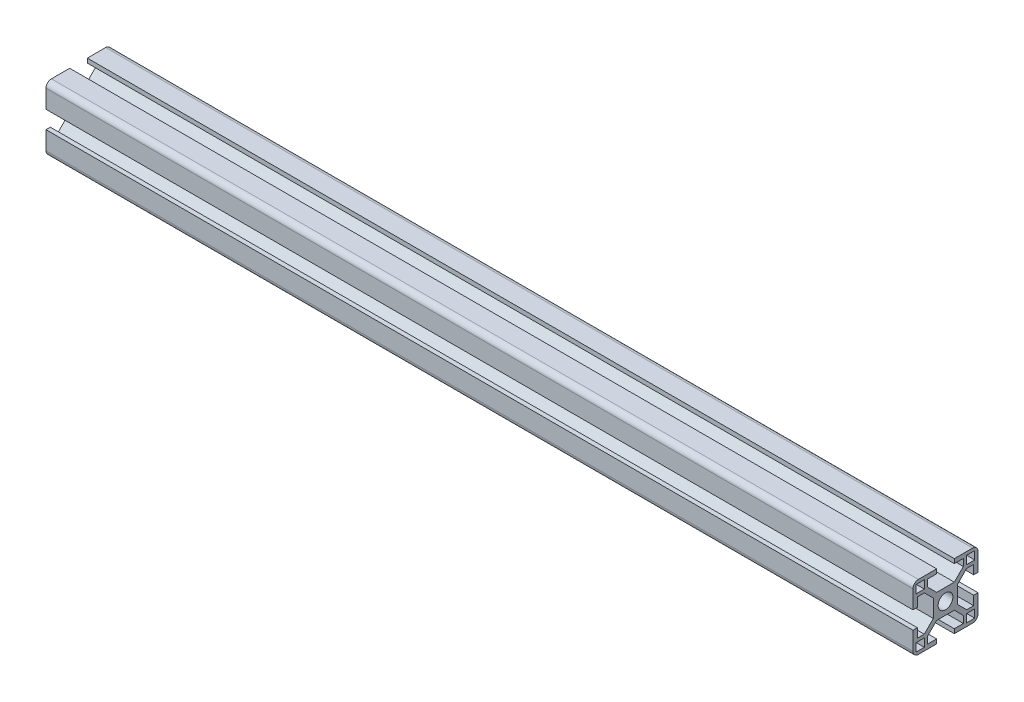
from build123d import *

# Parameters (mm, degrees)
SKETCH17_R                     = 3.4
SKETCH17_W                     = 3.75
SKETCH17_H                     = 3.75
T_SLOT_PROFILES_3030_2_1_DEPTH = 400


with BuildPart() as part:
    # Sketch17 → T-slot profiles 3030_2(1) (new body)
    with BuildSketch(Plane(origin=(0, 0, 0), x_dir=(0, 0, -1), z_dir=(1, 0, 0))):
        with BuildLine():
            Line((-4.07, 5.6), (4.07, 5.6))
            Line((4.07, 5.6), (8.25, 9.78))
            Line((8.25, 9.78), (8.25, 13))
            Line((8.25, 13), (4.07, 13))
            Line((4.07, 13), (4.07, 15))
            Line((4.07, 15), (12.5, 15))
            ThreePointArc((12.5, 15), (14.267766953, 14.267766953), (15, 12.5))
            Line((15, 12.5), (15, 4.07))
            Line((15, 4.07), (13, 4.07))
            Line((13, 4.07), (13, 8.25))
            Line((13, 8.25), (9.78, 8.25))
            Line((9.78, 8.25), (5.6, 4.07))
            Line((5.6, 4.07), (5.6, -4.07))
            Line((5.6, -4.07), (9.78, -8.25))
            Line((9.78, -8.25), (13, -8.25))
            Line((13, -8.25), (13, -4.07))
            Line((13, -4.07), (15, -4.07))
            Line((15, -4.07), (15, -12.5))
            ThreePointArc((15, -12.5), (14.267766953, -14.267766953), (12.5, -15))
            Line((12.5, -15), (4.07, -15))
            Line((4.07, -15), (4.07, -13))
            Line((4.07, -13), (8.25, -13))
            Line((8.25, -13), (8.25, -9.78))
            Line((8.25, -9.78), (4.07, -5.6))
            Line((4.07, -5.6), (-4.07, -5.6))
            Line((-4.07, -5.6), (-8.25, -9.78))
            Line((-8.25, -9.78), (-8.25, -13))
            Line((-8.25, -13), (-4.07, -13))
            Line((-4.07, -13), (-4.07, -15))
            Line((-4.07, -15), (-12.5, -15))
            ThreePointArc((-12.5, -15), (-14.267766953, -14.267766953), (-15, -12.5))
            Line((-15, -12.5), (-15, -4.07))
            Line((-15, -4.07), (-13, -4.07))
            Line((-13, -4.07), (-13, -8.25))
            Line((-13, -8.25), (-9.78, -8.25))
            Line((-9.78, -8.25), (-5.6, -4.07))
            Line((-5.6, -4.07), (-5.6, 4.07))
            Line((-5.6, 4.07), (-9.78, 8.25))
            Line((-9.78, 8.25), (-13, 8.25))
            Line((-13, 8.25), (-13, 4.07))
            Line((-13, 4.07), (-15, 4.07))
            Line((-15, 4.07), (-15, 12.5))
            ThreePointArc((-15, 12.5), (-14.267766953, 14.267766953), (-12.5, 15))
            Line((-12.5, 15), (-4.07, 15))
            Line((-4.07, 15), (-4.07, 13))
            Line((-4.07, 13), (-8.25, 13))
            Line((-8.25, 13), (-8.25, 9.78))
            Line((-8.25, 9.78), (-4.07, 5.6))
        make_face()
        Circle(SKETCH17_R, mode=Mode.SUBTRACT)
        with Locations((11.625, 11.625)):
            Rectangle(SKETCH17_W, SKETCH17_H, mode=Mode.SUBTRACT)
        with Locations((11.625, -11.625)):
            Rectangle(SKETCH17_W, SKETCH17_H, mode=Mode.SUBTRACT)
        with Locations((-11.625, 11.625)):
            Rectangle(SKETCH17_W, SKETCH17_H, mode=Mode.SUBTRACT)
        with Locations((-11.625, -11.625)):
            Rectangle(SKETCH17_W, SKETCH17_H, mode=Mode.SUBTRACT)
    extrude(amount=T_SLOT_PROFILES_3030_2_1_DEPTH)


solid = part.part
